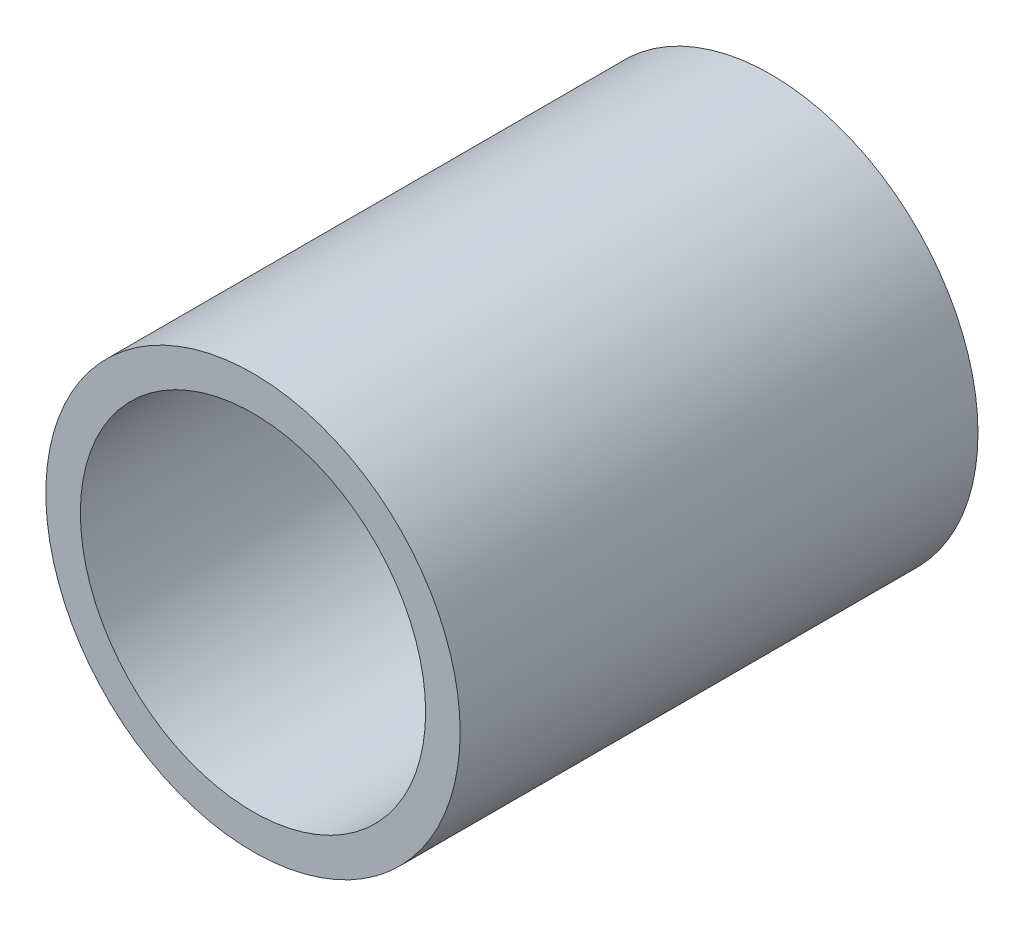
from build123d import *

# Parameters (mm, degrees)
SKETCH_1_R      = 6
SKETCH_1_R_2    = 5
EXTRUDE_1_DEPTH = 15


with BuildPart() as part:
    # 스케치1 → 보스-돌출1 (new body)
    with BuildSketch(Plane.XY):
        Circle(SKETCH_1_R)
        Circle(SKETCH_1_R_2, mode=Mode.SUBTRACT)
    extrude(amount=EXTRUDE_1_DEPTH)


solid = part.part
